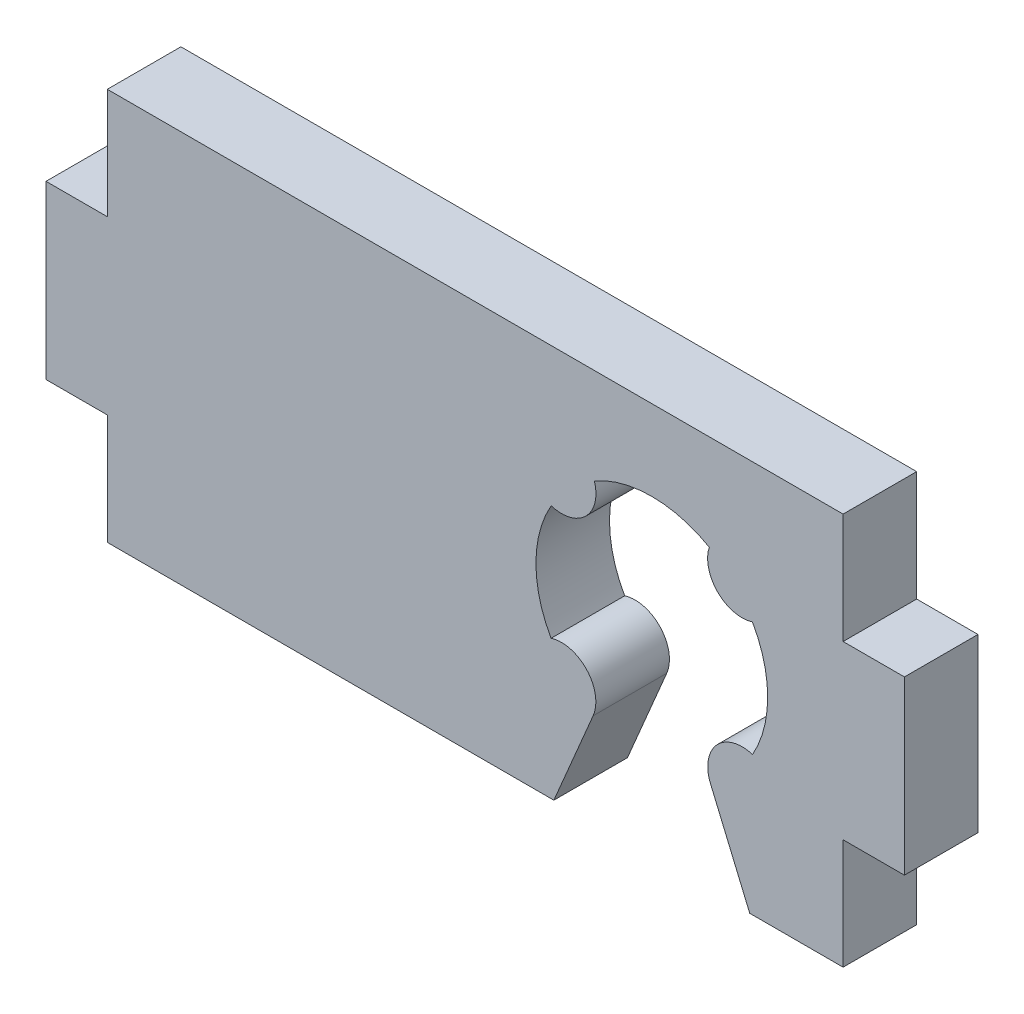
from build123d import *

# Parameters (mm, degrees)
BOSS_EXTRU_1_DEPTH = 3


with BuildPart() as part:
    # Esquisse1 → Boss.-Extru.1 (new body)
    with BuildSketch(Plane.XY):
        with BuildLine():
            Line((-24.7, -3.5), (-22.2, -3.5))
            Line((-22.2, -3.5), (-22.2, -8))
            Line((-22.2, -8), (-3.993420642, -8))
            Line((-3.993420642, -8), (-2.392209052, -4.218369106))
            ThreePointArc((-2.392209052, -4.218369106), (-2.646725452, -2.729399825), (-4.10580345, -2.338376153))
            ThreePointArc((-4.10580345, -2.338376153), (-4.724999134, 0.00286091), (-4.102968743, 2.343346431))
            ThreePointArc((-4.102968743, 2.343346431), (-2.687005769, 2.687005769), (-2.343346431, 4.102968743))
            ThreePointArc((-2.343346431, 4.102968743), (0, 4.725), (2.343346431, 4.102968743))
            ThreePointArc((2.343346431, 4.102968743), (2.687005769, 2.687005769), (4.102968743, 2.343346431))
            ThreePointArc((4.102968743, 2.343346431), (4.724999134, 0.00286091), (4.10580345, -2.338376153))
            ThreePointArc((4.10580345, -2.338376153), (2.646725452, -2.729399825), (2.392209052, -4.218369106))
            Line((2.392209052, -4.218369106), (3.993420642, -8))
            Line((3.993420642, -8), (7.8, -8))
            Line((7.8, -8), (7.8, -3.5))
            Line((7.8, -3.5), (10.3, -3.5))
            Line((10.3, -3.5), (10.3, 3.5))
            Line((10.3, 3.5), (7.8, 3.5))
            Line((7.8, 3.5), (7.8, 8))
            Line((7.8, 8), (-22.2, 8))
            Line((-22.2, 8), (-22.2, 3.5))
            Line((-22.2, 3.5), (-24.7, 3.5))
            Line((-24.7, 3.5), (-24.7, -3.5))
        make_face()
    extrude(amount=BOSS_EXTRU_1_DEPTH)


solid = part.part
